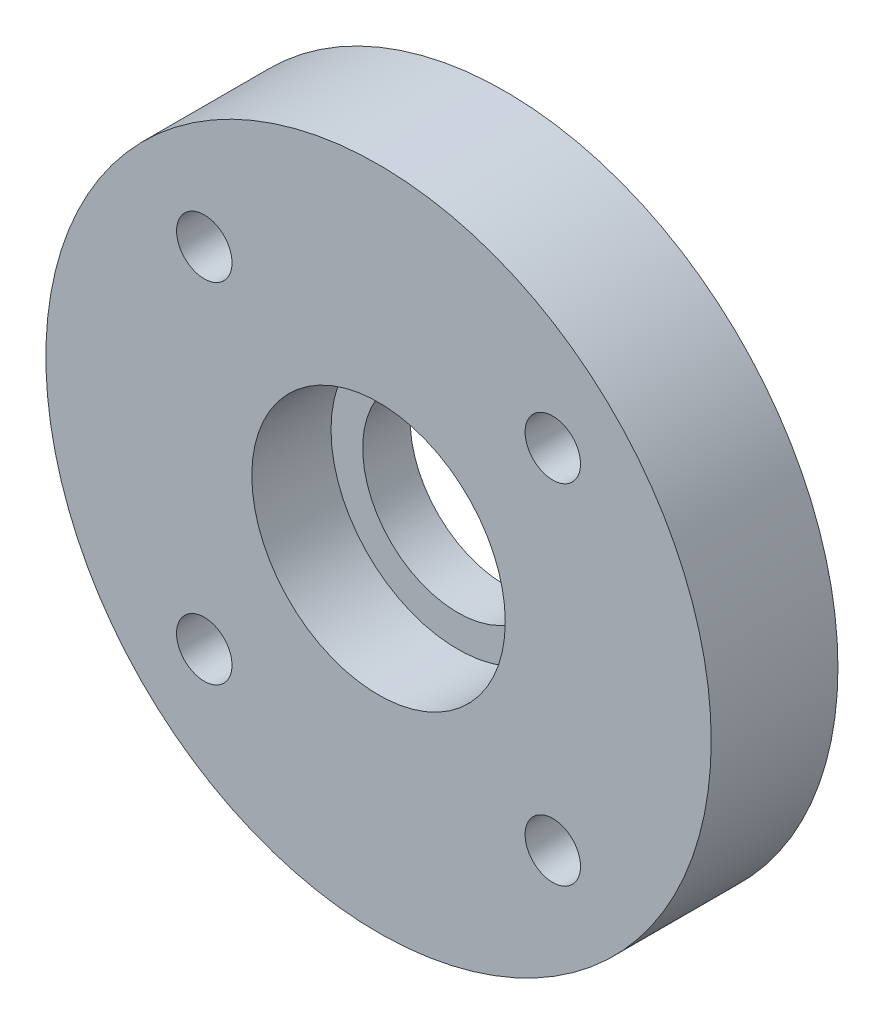
from build123d import *

# Parameters (mm, degrees)
SKETCH1_R           = 21
BOSS_EXTRUDE1_DEPTH = 8
SKETCH2_R           = 6
CUT_EXTRUDE1_DEPTH  = 31.757112998
SKETCH3_R           = 8
CUT_EXTRUDE2_DEPTH  = 5
SKETCH4_R           = 1.75
CUT_EXTRUDE3_DEPTH  = 31.757112998


with BuildPart() as part:
    # Sketch1 → Boss-Extrude1 (new body)
    with BuildSketch(Plane.XY):
        Circle(SKETCH1_R)
    extrude(amount=BOSS_EXTRUDE1_DEPTH)

    # Sketch2 → Cut-Extrude1 (cut, through all)
    with BuildSketch(Plane.XY.offset(8)):
        Circle(SKETCH2_R)
    extrude(amount=-CUT_EXTRUDE1_DEPTH, mode=Mode.SUBTRACT)

    # Sketch3 → Cut-Extrude2 (cut)
    with BuildSketch(Plane.XY.offset(8)):
        Circle(SKETCH3_R)
    extrude(amount=-CUT_EXTRUDE2_DEPTH, mode=Mode.SUBTRACT)

    # Sketch4 → Cut-Extrude3 (cut, through all)
    with BuildSketch(Plane.XY.offset(8)):
        with Locations((-11, 11)):
            Circle(SKETCH4_R)
        with Locations(Location((11, 11, 0), (0, 0, 180))):
            Circle(SKETCH4_R)
        with Locations((11, -11)):
            Circle(SKETCH4_R)
        with Locations(Location((-11, -11, 0), (0, 0, 180))):
            Circle(SKETCH4_R)
    extrude(amount=-CUT_EXTRUDE3_DEPTH, mode=Mode.SUBTRACT)


solid = part.part
